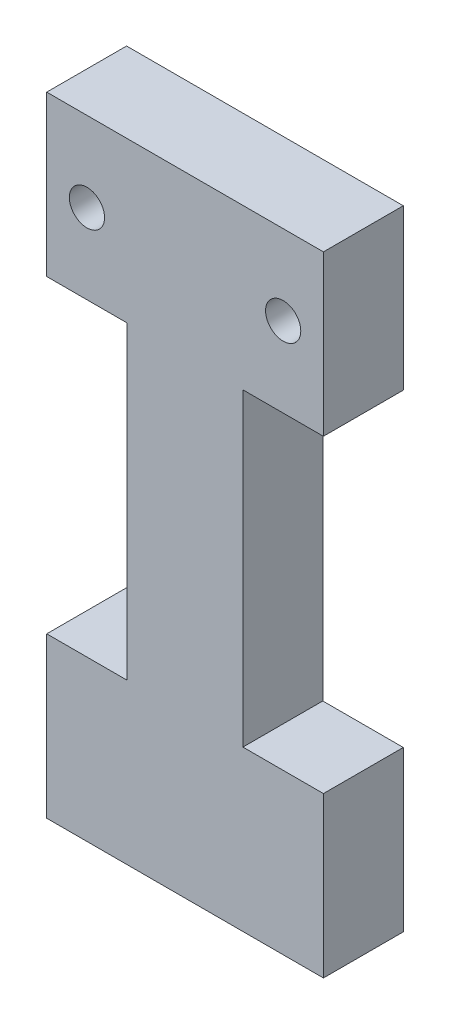
from build123d import *

# Parameters (mm, degrees)
SKETCH1_R           = 1.4
BOSS_EXTRUDE1_DEPTH = 6.35


with BuildPart() as part:
    # Sketch1 → Boss-Extrude1 (new body)
    with BuildSketch(Plane.XY):
        Polygon((11, -25), (11, -12.3), (4.6, -12.3), (4.6, 12.3), (11, 12.3), (11, 25), (-11, 25), (-11, 12.3), (-4.6, 12.3), (-4.6, -12.3), (-11, -12.3), (-11, -25), align=None)
        with Locations((7.8, 18.65)):
            Circle(SKETCH1_R, mode=Mode.SUBTRACT)
        with Locations((-7.8, 18.65)):
            Circle(SKETCH1_R, mode=Mode.SUBTRACT)
    extrude(amount=BOSS_EXTRUDE1_DEPTH)


solid = part.part
